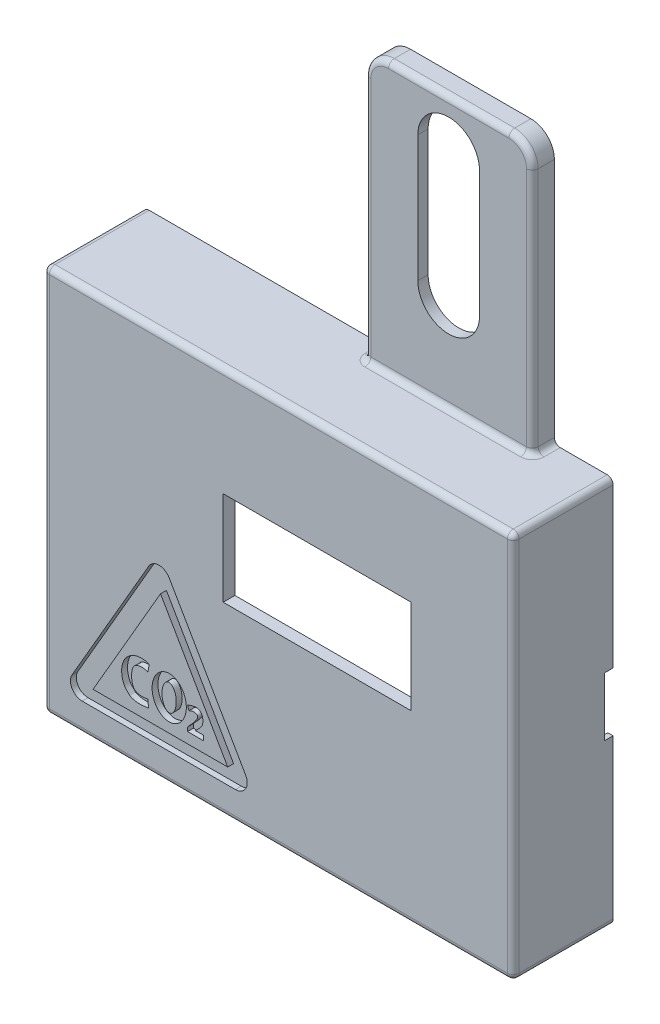
from build123d import *

# Parameters (mm, degrees)
CROQUIS1_W              = 80
CROQUIS1_H              = 66
SALIENTE_EXTRUIR2_DEPTH = 17
VACIADO7_T              = -2
CORTAR_EXTRUIR9_REACH   = 58.118
CROQUIS12_W             = 32
CROQUIS12_H             = 16
SALIENTE_EXTRUIR3_DEPTH = 3.75
CORTAR_EXTRUIR11_DEPTH  = 2
CORTAR_EXTRUIR26_REACH  = 117.461
CROQUIS16_W             = 10
CROQUIS16_H             = 12
CROQUIS20_RX            = 3.568577335
CROQUIS20_RY            = 2.914426882
CROQUIS20_RX_2          = 2.232634343
CROQUIS20_RY_2          = 1.215365865
CORTAR_EXTRUIR24_DEPTH  = 1
CORTAR_EXTRUIR25_REACH  = 117.461
CROQUIS27_W             = 1.5
CROQUIS27_H             = 10
REDONDEO3_R             = 1


with BuildPart() as part:
    # Croquis1 → Saliente-Extruir2 (new body)
    with BuildSketch(Plane.XY):
        with Locations((0, 2.5)):
            Rectangle(CROQUIS1_W, CROQUIS1_H)
    extrude(amount=SALIENTE_EXTRUIR2_DEPTH)

    # Vaciado7
    vaciado7_openings = [part.faces().sort_by_distance(p)[0] for p in [
        (0, 2.5, 0),
    ]]
    offset(amount=VACIADO7_T, openings=vaciado7_openings, kind=Kind.INTERSECTION)

    # Croquis12 → Cortar-Extruir9 (cut, up to next)
    with BuildSketch(Plane.XY.offset(17), mode=Mode.PRIVATE) as cortar_extruir9_sk1:
        with Locations((6.6, 9)):
            Rectangle(CROQUIS12_W, CROQUIS12_H)
    cortar_extruir9_tool1 = extrude(cortar_extruir9_sk1.sketch, amount=-CORTAR_EXTRUIR9_REACH, mode=Mode.PRIVATE) & part.part
    add(cortar_extruir9_tool1.solids().sort_by_distance((6.6, 9, 17))[0], mode=Mode.SUBTRACT)

    # Croquis29 → Saliente-Extruir3 (add)
    with BuildSketch(Plane(origin=(0, 0, 0), x_dir=(-1, 0, 0), z_dir=(0, 0, -1))):
        with BuildLine():
            Line((-1.5, 77.5), (-1.5, 35.5))
            Line((-1.5, 35.5), (-30, 35.5))
            Line((-30, 35.5), (-30, 77.5))
            ThreePointArc((-30, 77.5), (-28.828427125, 80.328427125), (-26, 81.5))
            Line((-26, 81.5), (-5.5, 81.5))
            ThreePointArc((-5.5, 81.5), (-2.671572875, 80.328427125), (-1.5, 77.5))
        make_face()
        with BuildLine():
            Line((-10.5, 73.25), (-10.5, 51.75))
            ThreePointArc((-10.5, 51.75), (-15.75, 46.5), (-21, 51.75))
            Line((-21, 51.75), (-21, 73.25))
            ThreePointArc((-21, 73.25), (-15.75, 78.5), (-10.5, 73.25))
        make_face(mode=Mode.SUBTRACT)
    extrude(amount=-SALIENTE_EXTRUIR3_DEPTH)

    # Croquis14 → Cortar-Extruir11 (cut)
    with BuildSketch(Plane(origin=(0, 0, 0), x_dir=(-1, 0, 0), z_dir=(0, 0, -1))):
        with BuildLine():
            Line((39.1, 34.6), (-2.4, 34.6))
            Line((-2.4, 34.6), (-2.4, 77.5))
            ThreePointArc((-2.4, 77.5), (-3.307968978, 79.692031022), (-5.5, 80.6))
            Line((-5.5, 80.6), (-26, 80.6))
            ThreePointArc((-26, 80.6), (-28.192031022, 79.692031022), (-29.1, 77.5))
            Line((-29.1, 77.5), (-29.1, 34.6))
            Line((-29.1, 34.6), (-39.1, 34.6))
            Line((-39.1, 34.6), (-39.1, -29.6))
            Line((-39.1, -29.6), (39.1, -29.6))
            Line((39.1, -29.6), (39.1, 34.6))
        make_face()
    extrude(amount=-CORTAR_EXTRUIR11_DEPTH, mode=Mode.SUBTRACT)

    # Croquis16 → Cortar-Extruir26 (cut, up to next)
    with BuildSketch(Plane.ZY.offset(40), mode=Mode.PRIVATE) as cortar_extruir26_sk1:
        with Locations((7, -12.75)):
            Rectangle(CROQUIS16_W, CROQUIS16_H)
    cortar_extruir26_tool1 = extrude(cortar_extruir26_sk1.sketch, amount=-CORTAR_EXTRUIR26_REACH, mode=Mode.PRIVATE) & part.part
    add(cortar_extruir26_tool1.solids().sort_by_distance((-40, -12.75, 7))[0], mode=Mode.SUBTRACT)

    # Croquis20 → Cortar-Extruir24 (cut)
    # profile 1 of 4: a face of its own
    with BuildSketch(Plane.XY.offset(17)):
        with BuildLine():
            Line((-18.590755698, -0.003579358), (-5.567484693, -22.587785135))
            ThreePointArc((-5.567484693, -22.587785135), (-5.568268134, -24.587332542), (-7.300057676, -25.586880154))
            Line((-7.300057676, -25.586880154), (-33.408883205, -25.586880154))
            ThreePointArc((-33.408883205, -25.586880154), (-35.141705867, -24.58554207), (-35.139387206, -22.584205777))
            Line((-35.139387206, -22.584205777), (-22.053832682, 0))
            ThreePointArc((-22.053832682, 0), (-20.321261528, 0.997324555), (-18.590755698, -0.003579358))
        make_face()
        Polygon((-8.62777783, -22.920674051), (-31.552205736, -22.920674051), (-20.06264827, -3.090980963), align=None, mode=Mode.SUBTRACT)
    # profile 2 of 4: a face of its own
    with BuildSketch(Plane.XY.offset(17)):
        with BuildLine():
            add(Edge.make_bspline(
                [(-22.220585459, -15.688668337), (-22.473316841, -15.63034571), (-22.720114648, -15.532860824), (-22.978779606, -15.513700456), (-23.250899762, -15.493543408), (-23.524824294, -15.535960138), (-23.795296381, -15.572023083), (-25.212214439, -15.760945491), (-25.122584621, -18.059259203), (-24.786781035, -18.954735434), (-24.397757557, -19.992131374), (-23.042460631, -19.849908777), (-22.220585459, -19.712929581)],
                knots=[0, 0, 0, 0, 1, 1, 1, 2, 2, 2, 3, 3, 3, 4, 4, 4, 4], degree=3))
            Line((-22.220585459, -19.712929581), (-22.103940205, -20.996027369))
            add(Edge.make_bspline(
                [(-22.103940205, -20.996027369), (-23.28060818, -21.143110866), (-24.188386831, -21.254263886), (-25.253362049, -20.762736862), (-25.303288102, -20.739694069), (-25.331125551, -20.68497336), (-25.370007302, -20.646091609), (-25.753754737, -20.262344174), (-26.08625723, -20.026013927), (-26.30316933, -19.537961701), (-27.149632898, -17.633418674), (-26.592646966, -15.27423428), (-24.611813155, -14.463893175), (-23.752583307, -14.112390056), (-22.840530525, -14.122598946), (-21.987294952, -14.463893175)],
                knots=[0, 0, 0, 0, 1, 1, 1, 2, 2, 2, 3, 3, 3, 4, 4, 4, 5, 5, 5, 5], degree=3))
            Line((-21.987294952, -14.463893175), (-22.220585459, -15.688668337))
        make_face()
    # profile 3 of 4: a face of its own
    with BuildSketch(Plane.XY.offset(17)):
        with Locations(Location((-18.587049995, -17.670107047), (0, 0, -90.640192277))):
            Ellipse(CROQUIS20_RX, CROQUIS20_RY)
        with Locations(Location((-18.601854743, -17.667818984), (0, 0, -89.299840613))):
            Ellipse(CROQUIS20_RX_2, CROQUIS20_RY_2, mode=Mode.SUBTRACT)
    # profile 4 of 4: a face of its own
    with BuildSketch(Plane.XY.offset(17)):
        with BuildLine():
            add(Edge.make_bspline(
                [(-15.455160758, -21.112672623), (-15.435719882, -20.85994124), (-15.496688009, -20.587461524), (-15.396838131, -20.354478475), (-15.283211235, -20.089349051), (-12.445503229, -17.671637646), (-14.463676103, -17.671637646), (-14.869932367, -17.671637646), (-14.884905464, -17.820686956), (-15.221870251, -17.904928152)],
                knots=[0, 0, 0, 0, 1, 1, 1, 2, 2, 2, 3, 3, 3, 3], degree=3))
            Line((-15.221870251, -17.904928152), (-15.455160758, -17.205056632))
            add(Edge.make_bspline(
                [(-15.455160758, -17.205056632), (-13.86644657, -16.410699538), (-12.632559042, -16.798398876), (-12.888965182, -18.721444927), (-12.955583326, -19.221081006), (-13.831530636, -19.988290714), (-14.113740343, -20.296155848)],
                knots=[0, 0, 0, 0, 1, 1, 1, 2, 2, 2, 2], degree=3))
            Line((-14.113740343, -20.296155848), (-12.712782774, -20.296155848))
            Line((-12.712782774, -20.296155848), (-12.712782774, -21.114840351))
            Line((-12.712782774, -21.114840351), (-15.455160758, -21.112672623))
        make_face()
    extrude(amount=-CORTAR_EXTRUIR24_DEPTH, mode=Mode.SUBTRACT)

    # Croquis27 → Cortar-Extruir25 (cut, up to next)
    with BuildSketch(Plane(origin=(40, 0, 0), x_dir=(0, 0, -1), z_dir=(1, 0, 0)), mode=Mode.PRIVATE) as cortar_extruir25_sk1:
        with Locations((-0.75, 2.5)):
            Rectangle(CROQUIS27_W, CROQUIS27_H)
    cortar_extruir25_tool1 = extrude(cortar_extruir25_sk1.sketch, amount=-CORTAR_EXTRUIR25_REACH, mode=Mode.PRIVATE) & part.part
    add(cortar_extruir25_tool1.solids().sort_by_distance((40, 2.5, 0.75))[0], mode=Mode.SUBTRACT)

    # Redondeo3
    redondeo3_edges = [part.edges().sort_by_distance(p)[0] for p in [
        (-40, 2.5, 17),
        (0, -30.5, 17),
        (28.828427125, 80.328427125, 3.75),
        (15.75, 81.5, 3.75),
        (2.671572875, 80.328427125, 3.75),
        (1.5, 56.5, 3.75),
        (15.75, 35.5, 3.75),
        (1.5, 35.5, 1.875),
        (30, 56.5, 3.75),
        (30, 35.5, 1.875),
        (40, 2.5, 17),
        (40, -30.5, 8.5),
        (-40, -30.5, 8.5),
        (-40, 35.5, 8.5),
        (40, 35.5, 8.5),
        (0, 35.5, 17),
    ]]
    fillet(redondeo3_edges, radius=REDONDEO3_R)


solid = part.part
